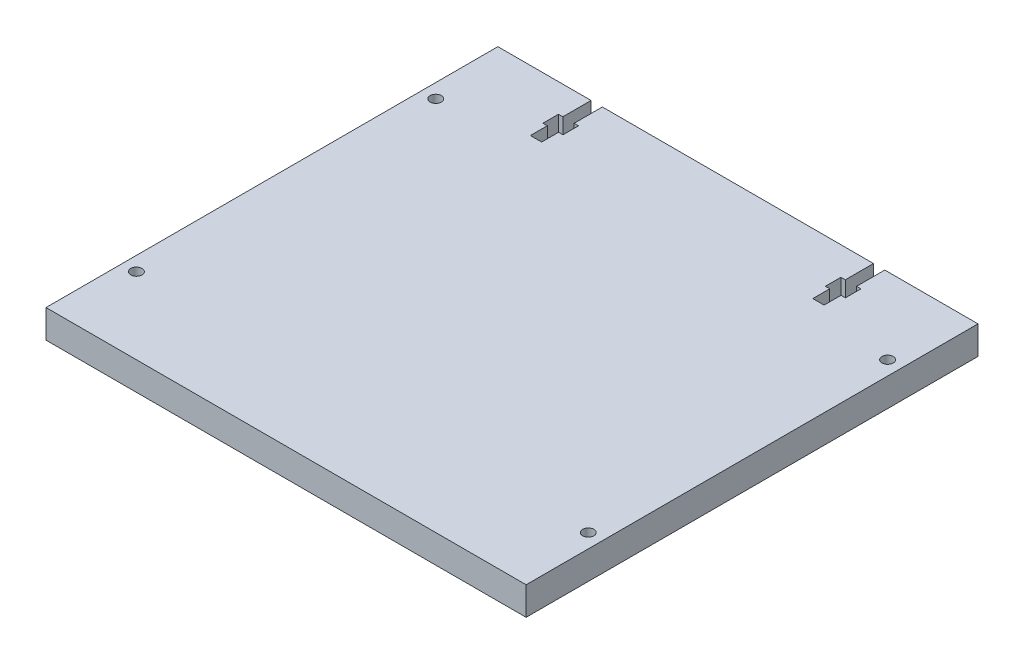
from build123d import *

# Parameters (mm, degrees)
SKETCH1_W               = 170
SKETCH1_H               = 10
BOSS_EXTRUDE1_DEPTH     = 160
ESQUISSE1_R             = 2
ENL_V_MAT_EXTRU_2_DEPTH = 10
ENL_V_MAT_EXTRU_3_DEPTH = 10


with BuildPart() as part:
    # Sketch1 → Boss-Extrude1 (new body)
    with BuildSketch(Plane.XY):
        with Locations((85, 5)):
            Rectangle(SKETCH1_W, SKETCH1_H)
    extrude(amount=BOSS_EXTRUDE1_DEPTH)

    # Esquisse1 → Enlèv. mat.-Extru.2 (cut)
    with BuildSketch(Plane.XZ):
        with Locations(Location((5, 133, 0), (0, 0, 270))):
            Circle(ESQUISSE1_R)
        with Locations(Location((5, 27, 0), (0, 0, 90))):
            Circle(ESQUISSE1_R)
        with Locations(Location((165, 27, 0), (0, 0, 270))):
            Circle(ESQUISSE1_R)
        with Locations(Location((165, 133, 0), (0, 0, 90))):
            Circle(ESQUISSE1_R)
    extrude(amount=-ENL_V_MAT_EXTRU_2_DEPTH, mode=Mode.SUBTRACT)

    # Esquisse2 → Enlèv. mat.-Extru.3 (cut)
    with BuildSketch(Plane(origin=(0, 0, 0), x_dir=(-1, 0, 0), z_dir=(0, -1, 0))):
        Polygon((-133, -10), (-133, 0), (-137, 0), (-137, -10), (-138.55, -10), (-138.55, -15.5), (-137, -15.5), (-137, -21.5), (-133, -21.5), (-133, -15.5), (-131.45, -15.5), (-131.45, -10), align=None)
        Polygon((-33, -10), (-33, 0), (-37, 0), (-37, -10), (-38.55, -10), (-38.55, -15.5), (-37, -15.5), (-37, -21.5), (-33, -21.5), (-33, -15.5), (-31.45, -15.5), (-31.45, -10), align=None)
    extrude(amount=-ENL_V_MAT_EXTRU_3_DEPTH, mode=Mode.SUBTRACT)


solid = part.part
